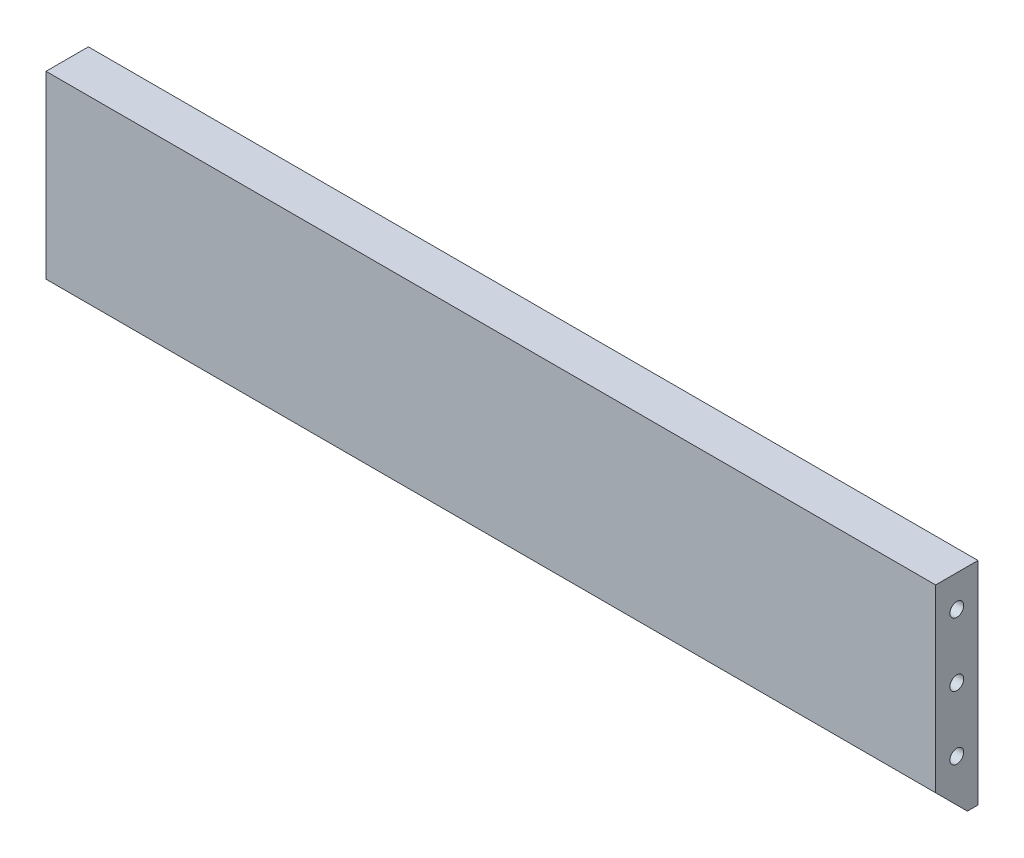
from build123d import *

# Parameters (mm, degrees)
IZIM1_W                     = 420
IZIM1_H                     = 100
Y_KSEKLIK_EKSTR_ZYON1_DEPTH = 20
PAH1_SIZE                   = 15
IZIM2_R                     = 3.25
KES_EKSTR_ZYON1_DEPTH       = 30


with BuildPart() as part:
    # Çizim1 → Yükseklik-Ekstrüzyon1 (new body)
    with BuildSketch(Plane.XY):
        Rectangle(IZIM1_W, IZIM1_H)
    extrude(amount=Y_KSEKLIK_EKSTR_ZYON1_DEPTH)

    # Pah1
    pah1_edges = [part.edges().sort_by_distance(p)[0] for p in [
        (0, -50, 20),
    ]]
    chamfer(pah1_edges, length=PAH1_SIZE)

    # Çizim2 → Kes-Ekstrüzyon1 (cut)
    with BuildSketch(Plane(origin=(210, 0, 0), x_dir=(0, 0, -1), z_dir=(1, 0, 0))):
        with Locations((-10, 35)):
            Circle(IZIM2_R)
        with Locations((-10, 5)):
            Circle(IZIM2_R)
        with Locations((-10, -25)):
            Circle(IZIM2_R)
    kes_ekstr_zyon1 = extrude(amount=-KES_EKSTR_ZYON1_DEPTH, mode=Mode.SUBTRACT)

    # Aynalama1: Kes-Ekstrüzyon1 across plane
    add(kes_ekstr_zyon1.mirror(Plane(origin=(0, 0, 0), x_dir=(0, 0, 1), z_dir=(1, 0, 0))), mode=Mode.SUBTRACT)


solid = part.part
